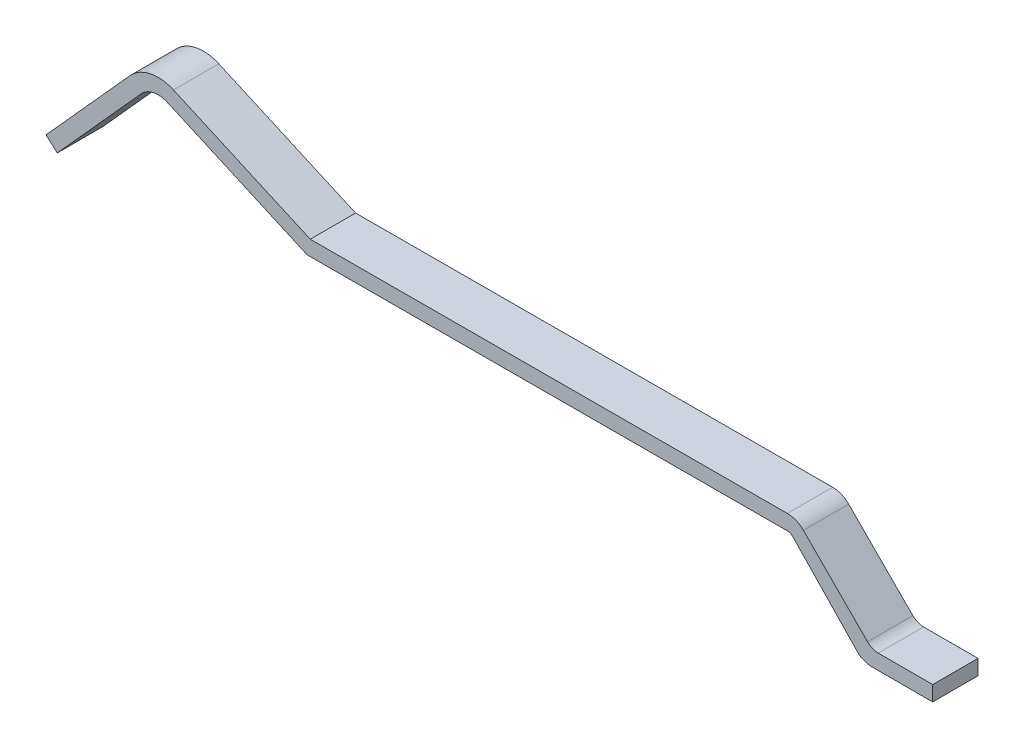
from build123d import *

# Parameters (mm, degrees)
RESSALTO_EXTRUS_O1_DEPTH = 0.3


with BuildPart() as part:
    # Esboço1 → Ressalto-extrusão1 (new, symmetric)
    with BuildSketch(Plane.XY):
        with BuildLine():
            Line((20.691752756, 0.204274437), (20.691752756, 0.004274437))
            Line((20.691752756, 0.004274437), (19.891752756, 0.004274437))
            ThreePointArc((19.891752756, 0.004274437), (19.796884427, 0.019669447), (19.711752756, 0.064274437))
            Line((19.711752756, 0.064274437), (18.838199366, 0.975083322))
            ThreePointArc((18.838199366, 0.975083322), (18.805773821, 0.996800576), (18.767488688, 1.004370491))
            Line((18.767488688, 1.004370491), (12.407488688, 0.99))
            Line((12.407488688, 0.99), (10.557971552, 1.813458083))
            ThreePointArc((10.557971552, 1.813458083), (10.373577052, 1.832838725), (10.213007112, 1.740133627))
            Line((10.213007112, 1.740133627), (9.099531826, 0.503494039))
            Line((9.099531826, 0.503494039), (8.95090286, 0.637320161))
            Line((8.95090286, 0.637320161), (10.064378147, 1.873959748))
            ThreePointArc((10.064378147, 1.873959748), (10.331994714, 2.028468246), (10.639318881, 1.996167174))
            Line((10.639318881, 1.996167174), (12.45, 1.19))
            Line((12.45, 1.19), (18.767488688, 1.204274437))
            ThreePointArc((18.767488688, 1.204274437), (18.882345327, 1.181562894), (18.979620722, 1.116406471))
            Line((18.979620722, 1.116406471), (19.829007121, 0.263172984))
            ThreePointArc((19.829007121, 0.263172984), (19.894002269, 0.219585116), (19.970747658, 0.204274437))
            Line((19.970747658, 0.204274437), (20.691752756, 0.204274437))
        make_face()
    extrude(amount=RESSALTO_EXTRUS_O1_DEPTH, both=True)


solid = part.part
